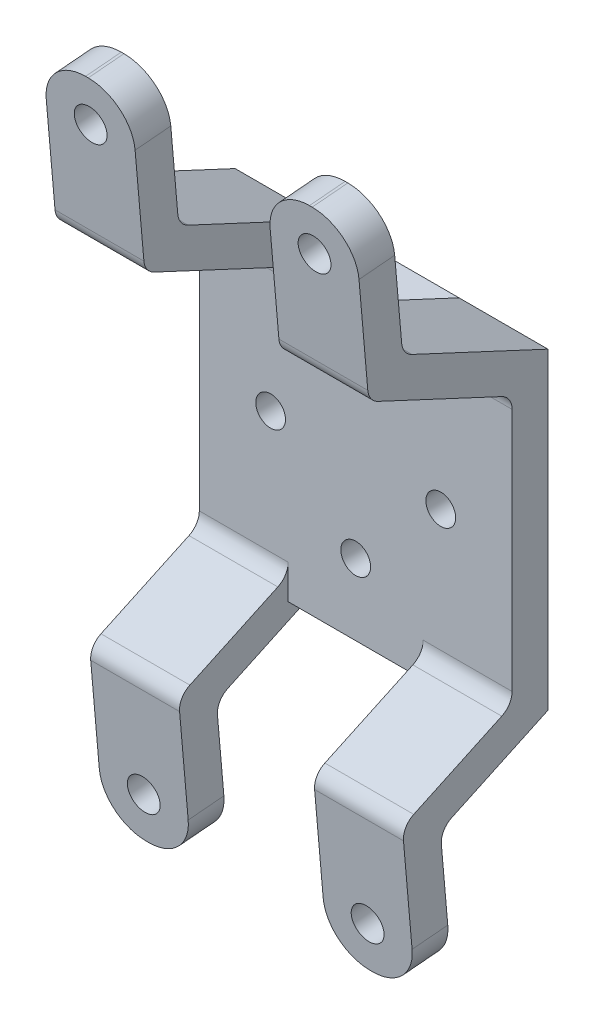
from build123d import *

# Parameters (mm, degrees)
SKETCH1_W             = 34.925
SKETCH1_H             = 34.925
SKETCH1_R             = 1.6625
BOSS_EXTRUDE4_DEPTH   = 4
BOSS_EXTRUDE7_DEPTH   = 9.925
F_6_CLEARANCE_HOLE1_D = 3.6576
FILLET1_R             = 4.8125
FILLET2_R             = 2
FILLET1_OF_MIRROR1_R  = 4.8125
FILLET2_OF_MIRROR1_R  = 2


with BuildPart() as part:
    # Sketch1 → Boss-Extrude4 (new body)
    with BuildSketch(Plane.XY):
        Rectangle(SKETCH1_W, SKETCH1_H)
        with Locations((0, 9.5)):
            Circle(SKETCH1_R, mode=Mode.SUBTRACT)
        with Locations((9.5, 0)):
            Circle(SKETCH1_R, mode=Mode.SUBTRACT)
        with Locations((-9.5, 0)):
            Circle(SKETCH1_R, mode=Mode.SUBTRACT)
        with Locations((0, -9.5)):
            Circle(SKETCH1_R, mode=Mode.SUBTRACT)
    extrude(amount=-BOSS_EXTRUDE4_DEPTH)

    # Sketch7 → Boss-Extrude7 (add)
    with BuildSketch(Plane.ZY.offset(17.4625)):
        Polygon((0, 14.914218957), (11.825462524, 20.428522693), (16.011518882, 22.38051283), (17.512960324, 39.542067038), (13.528181531, 39.890690009), (12.228017656, 25.02974891), (-4, 17.4625), align=None)
        Polygon((8.02005001, -23.067541371), (6.762717001, -37.43892343), (10.747495793, -37.787546401), (12.248937235, -20.625992194), (8.391046827, -18.827028352), (0, -14.914218957), (-4, -17.4625), align=None)
    boss_extrude7 = extrude(amount=-BOSS_EXTRUDE7_DEPTH)

    # #6 Clearance Hole1 (through all)
    with Locations(Plane(origin=(0, -1.220180398, 13.946725773), x_dir=(1, 0, 0), z_dir=(0, -0.08715574274765159, 0.9961946980917462))):
        with Locations((-12.5, 36.1054526), (-12.5, -31.8945474)):
            f_6_clearance_hole1 = Hole(F_6_CLEARANCE_HOLE1_D / 2)

    # Fillet1
    fillet1_edges = [part.edges().sort_by_distance(p)[0] for p in [
        (-7.5375, -37.613234916, 8.755106397),
        (-17.4625, -37.613234916, 8.755106397),
        (-17.4625, 39.716378524, 15.520570928),
        (-7.5375, 39.716378524, 15.520570928),
    ]]
    fillet(fillet1_edges, radius=FILLET1_R)

    # Fillet2
    fillet2_edges = [part.edges().sort_by_distance(p)[0] for p in [
        (-12.5, -20.625992194, 12.248937235),
        (-12.5, -23.067541371, 8.02005001),
        (-12.5, -14.914218957, 0),
        (-12.5, 22.38051283, 16.011518882),
        (-12.5, 14.914218957, 0),
        (-12.5, 25.02974891, 12.228017656),
    ]]
    fillet(fillet2_edges, radius=FILLET2_R)

    # Mirror1: Boss-Extrude7, #6 Clearance Hole1 across plane
    add(boss_extrude7.mirror(Plane(origin=(0, 0, 0), x_dir=(0, 0, 1), z_dir=(1, 0, 0))))
    add(f_6_clearance_hole1.mirror(Plane(origin=(0, 0, 0), x_dir=(0, 0, 1), z_dir=(1, 0, 0))), mode=Mode.SUBTRACT)

    # Fillet1 of Mirror1
    fillet1_of_mirror1_edges = [part.edges().sort_by_distance(p)[0] for p in [
        (7.5375, -37.613234916, 8.755106397),
        (17.4625, -37.613234916, 8.755106397),
        (17.4625, 39.716378524, 15.520570928),
        (7.5375, 39.716378524, 15.520570928),
    ]]
    fillet(fillet1_of_mirror1_edges, radius=FILLET1_OF_MIRROR1_R)

    # Fillet2 of Mirror1
    fillet2_of_mirror1_edges = [part.edges().sort_by_distance(p)[0] for p in [
        (12.5, -20.625992194, 12.248937235),
        (12.5, -23.067541371, 8.02005001),
        (12.5, -14.914218957, 0),
        (12.5, 22.38051283, 16.011518882),
        (12.5, 14.914218957, 0),
        (12.5, 25.02974891, 12.228017656),
    ]]
    fillet(fillet2_of_mirror1_edges, radius=FILLET2_OF_MIRROR1_R)


solid = part.part
